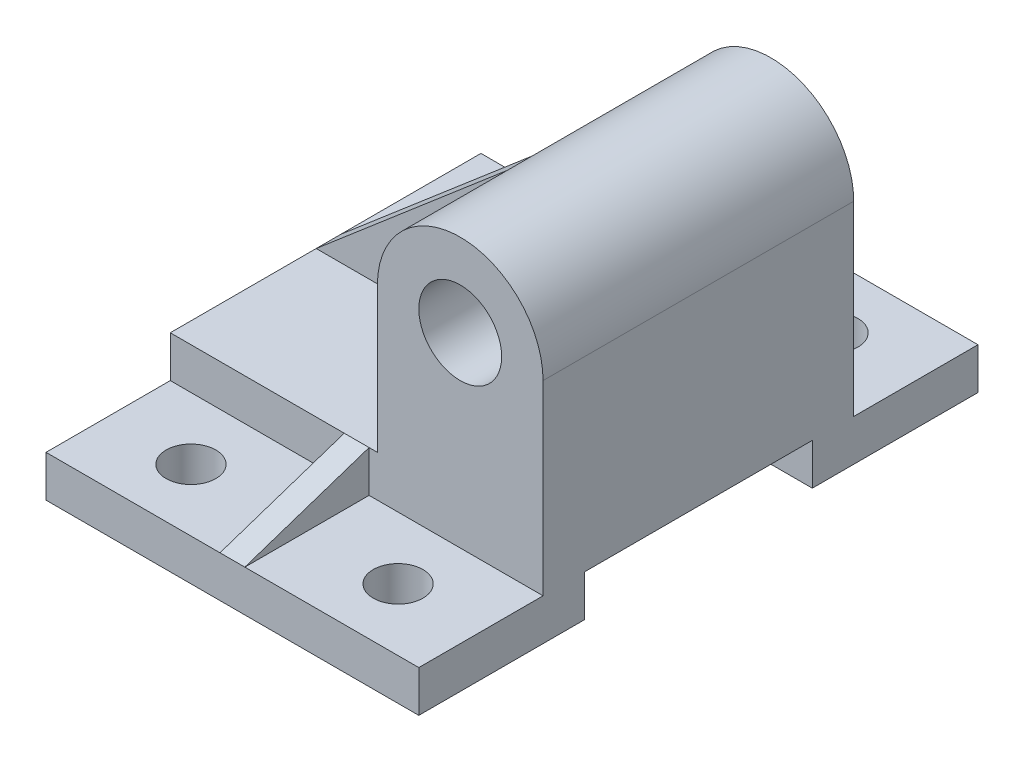
from build123d import *

# Parameters (mm, degrees)
SKETCH2_R                = 10
BOSS_EXTRUDE1_DEPTH      = 135
SKETCH4_W                = 90
SKETCH4_H                = 10
CUT_EXTRUDE1_DEPTH       = 30
SKETCH6_W                = 90
SKETCH6_H                = 10
CUT_EXTRUDE2_DEPTH       = 30
CUT_EXTRUDE3_DEPTH       = 30
CUT_EXTRUDE4_START       = -30
CUT_EXTRUDE4_DEPTH       = 30
SKETCH11_W               = 55
SKETCH11_H               = 20
CUT_EXTRUDE5_DEPTH       = 167.527024834
SKETCH12_R               = 6
CUT_EXTRUDE6_DEPTH       = 165.335784295
SKETCH13_R               = 6
CUT_EXTRUDE7_DEPTH       = 165.335784295
SKETCH14_W               = 6
SKETCH14_H               = 30
BOSS_EXTRUDE3_DEPTH      = 10
SKETCH15_W               = 6
SKETCH15_H               = 30
BOSS_EXTRUDE4_DEPTH      = 10
CUT_EXTRUDE8_DEPTH       = 149.105536696
CUT_EXTRUDE8_DEPTH_BACK  = 149.105536696
CUT_EXTRUDE9_DEPTH       = 149.105536696
CUT_EXTRUDE9_DEPTH_BACK  = 149.105536696
BOSS_EXTRUDE5_DEPTH      = 50
BOSS_EXTRUDE5_DEPTH_BACK = 10
SKETCH18_W               = 6
SKETCH18_H               = 45
CUT_EXTRUDE10_DEPTH      = 106.048466338
CUT_EXTRUDE10_DEPTH_BACK = 106.048466338


with BuildPart() as part:
    # Sketch2 → Boss-Extrude1 (new body)
    with BuildSketch(Plane.XY):
        with BuildLine():
            Line((67.5, 17.5), (67.5, -37.5))
            Line((67.5, -37.5), (-22.5, -37.5))
            Line((-22.5, -37.5), (-22.5, -17.5))
            Line((-22.5, -17.5), (27.5, -17.5))
            Line((27.5, -17.5), (27.5, 17.5))
            ThreePointArc((27.5, 17.5), (47.5, 37.5), (67.5, 17.5))
        make_face()
        with Locations((47.5, 17.5)):
            Circle(SKETCH2_R, mode=Mode.SUBTRACT)
    extrude(amount=BOSS_EXTRUDE1_DEPTH)

    # Sketch4 → Cut-Extrude1 (cut)
    with BuildSketch(Plane.XY.offset(135)):
        with Locations((22.5, -22.5)):
            Rectangle(SKETCH4_W, SKETCH4_H)
    extrude(amount=-CUT_EXTRUDE1_DEPTH, mode=Mode.SUBTRACT)

    # Sketch6 → Cut-Extrude2 (cut)
    with BuildSketch(Plane(origin=(0, 0, 0), x_dir=(-1, 0, 0), z_dir=(0, 0, -1))):
        with Locations((-22.5, -22.5)):
            Rectangle(SKETCH6_W, SKETCH6_H)
    extrude(amount=-CUT_EXTRUDE2_DEPTH, mode=Mode.SUBTRACT)

    # Sketch9 → Cut-Extrude3 (cut)
    with BuildSketch(Plane(origin=(0, 0, 0), x_dir=(-1, 0, 0), z_dir=(0, 0, -1))):
        with BuildLine():
            Line((-67.5, -17.5), (-67.5, 17.5))
            ThreePointArc((-67.5, 17.5), (-47.5, 37.5), (-27.5, 17.5))
            Line((-27.5, 17.5), (-27.5, -17.5))
            Line((-27.5, -17.5), (-67.5, -17.5))
        make_face()
    extrude(amount=-CUT_EXTRUDE3_DEPTH, mode=Mode.SUBTRACT)

    # Sketch10 → Cut-Extrude4 (cut)
    with BuildSketch(Plane.XY.offset(135).offset(CUT_EXTRUDE4_START)):
        with BuildLine():
            Line((27.5, -17.5), (67.5, -17.5))
            Line((67.5, -17.5), (67.5, 17.5))
            ThreePointArc((67.5, 17.5), (47.5, 37.5), (27.5, 17.5))
            Line((27.5, 17.5), (27.5, -17.5))
        make_face()
    extrude(amount=CUT_EXTRUDE4_DEPTH, mode=Mode.SUBTRACT)

    # Sketch11 → Cut-Extrude5 (cut, through all)
    with BuildSketch(Plane.ZY.offset(22.5)):
        with Locations((67.5, -37.5)):
            Rectangle(SKETCH11_W, SKETCH11_H)
    extrude(amount=-CUT_EXTRUDE5_DEPTH, mode=Mode.SUBTRACT)

    # Sketch12 → Cut-Extrude6 (cut, through all)
    with BuildSketch(Plane(origin=(0, -27.5, 0), x_dir=(1, 0, 0), z_dir=(0, 1, 0))):
        with Locations(Location((-2.5, -120, 0), (0, 0, 270))):
            Circle(SKETCH12_R)
        with Locations(Location((47.5, -120, 0), (0, 0, 270))):
            Circle(SKETCH12_R)
    extrude(amount=-CUT_EXTRUDE6_DEPTH, mode=Mode.SUBTRACT)

    # Sketch13 → Cut-Extrude7 (cut, through all)
    with BuildSketch(Plane(origin=(0, -27.5, 0), x_dir=(1, 0, 0), z_dir=(0, 1, 0))):
        with Locations(Location((47.5, -15, 0), (0, 0, 180))):
            Circle(SKETCH13_R)
        with Locations(Location((-2.5, -15, 0), (0, 0, 180))):
            Circle(SKETCH13_R)
    extrude(amount=-CUT_EXTRUDE7_DEPTH, mode=Mode.SUBTRACT)

    # Sketch14 → Boss-Extrude3 (add)
    with BuildSketch(Plane(origin=(0, -27.5, 0), x_dir=(1, 0, 0), z_dir=(0, 1, 0))):
        with Locations((22.5, -120)):
            Rectangle(SKETCH14_W, SKETCH14_H)
    extrude(amount=BOSS_EXTRUDE3_DEPTH)

    # Sketch15 → Boss-Extrude4 (add)
    with BuildSketch(Plane(origin=(0, -27.5, 0), x_dir=(1, 0, 0), z_dir=(0, 1, 0))):
        with Locations((22.5, -15)):
            Rectangle(SKETCH15_W, SKETCH15_H)
    extrude(amount=BOSS_EXTRUDE4_DEPTH)

    # Sketch16 → Cut-Extrude8 (cut, two sides: drawn at the far end of the back side and taken through both)
    with BuildSketch(Plane.ZY.offset(-19.5).offset(-CUT_EXTRUDE8_DEPTH_BACK)):
        Polygon((105, -17.5), (135, -27.5), (135, -17.5), align=None)
    extrude(amount=CUT_EXTRUDE8_DEPTH + CUT_EXTRUDE8_DEPTH_BACK, mode=Mode.SUBTRACT)

    # Sketch17 → Cut-Extrude9 (cut, two sides: drawn at the far end of the back side and taken through both)
    with BuildSketch(Plane.ZY.offset(-19.5).offset(-CUT_EXTRUDE9_DEPTH_BACK)):
        Polygon((30, -17.5), (0, -27.5), (0, -17.5), align=None)
    extrude(amount=CUT_EXTRUDE9_DEPTH + CUT_EXTRUDE9_DEPTH_BACK, mode=Mode.SUBTRACT)

    # Sketch18 → Boss-Extrude5 (add, two sides: drawn at the far end of the back side and taken through both)
    with BuildSketch(Plane.ZY.offset(-27.5).offset(-BOSS_EXTRUDE5_DEPTH_BACK)):
        with Locations((66.77724886, 5)):
            Rectangle(SKETCH18_W, SKETCH18_H)
    extrude(amount=BOSS_EXTRUDE5_DEPTH + BOSS_EXTRUDE5_DEPTH_BACK)

    # Sketch19 → Cut-Extrude10 (cut, two sides: drawn at the far end of the back side and taken through both)
    with BuildSketch(Plane(origin=(0, 0, 63.77724886), x_dir=(-1, 0, 0), z_dir=(0, 0, -1)).offset(-CUT_EXTRUDE10_DEPTH_BACK)):
        Polygon((22.5, -17.5), (-30.179491924, 27.5), (22.5, 27.5), align=None)
    extrude(amount=CUT_EXTRUDE10_DEPTH + CUT_EXTRUDE10_DEPTH_BACK, mode=Mode.SUBTRACT)


solid = part.part
